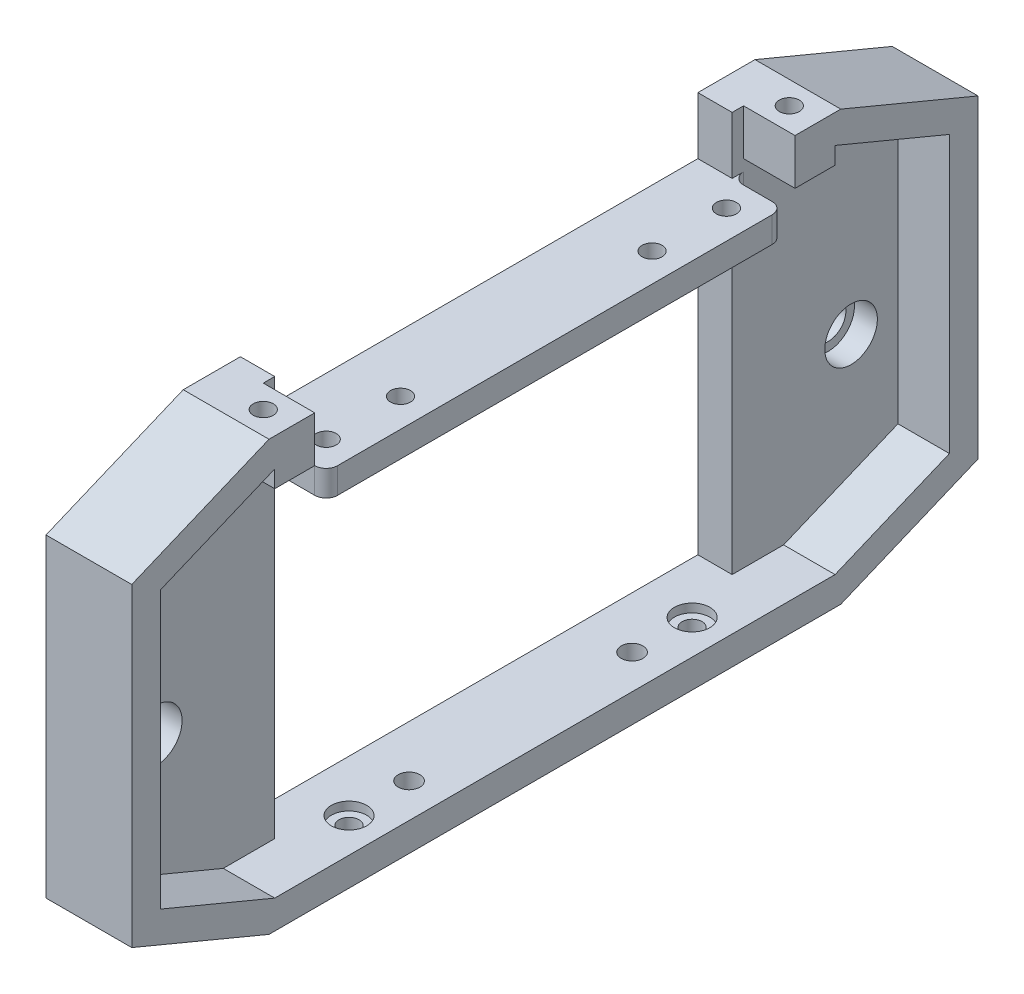
from build123d import *

# Parameters (mm, degrees)
SKETCH13_R              = 4.6
SKETCH13_W              = 80
SKETCH13_H              = 55
BOSS_EXTRUDE4_DEPTH     = 15
CUT_EXTRUDE1_DEPTH      = 9
CUT_EXTRUDE2_DEPTH      = 146.691454794
CUT_EXTRUDE2_DEPTH_BACK = 6
SKETCH16_R              = 1.75
FILLET1_R               = 2
SKETCH17_R              = 1.75
CUT_EXTRUDE3_DEPTH      = 10
SKETCH18_R              = 1.75
SKETCH18_R_2            = 1.9
CUT_EXTRUDE4_DEPTH      = 10
SKETCH21_R              = 4.6
SKETCH21_R_2            = 3.1
BOSS_EXTRUDE7_DEPTH     = 2
SKETCH22_R              = 3.1
CUT_EXTRUDE5_DEPTH      = 1.5
SKETCH23_W              = 9
SKETCH23_H              = 7
SKETCH23_R              = 1.75
BOSS_EXTRUDE8_DEPTH     = 3


with BuildPart() as part:
    # Sketch13 → Boss-Extrude4 (new body)
    with BuildSketch(Plane(origin=(0, 0, 0), x_dir=(0, 0, -1), z_dir=(1, 0, 0))):
        Polygon((0, 0), (-24, 10), (-24, 65), (0, 75), (10, 75), (10, 65), (90, 65), (90, 75), (100, 75), (124, 65), (124, 10), (100, 0), align=None)
        with Locations((-10.8, 31)):
            Circle(SKETCH13_R, mode=Mode.SUBTRACT)
        with Locations((110.8, 31)):
            Circle(SKETCH13_R, mode=Mode.SUBTRACT)
        with Locations((50, 32.5)):
            Rectangle(SKETCH13_W, SKETCH13_H, mode=Mode.SUBTRACT)
    extrude(amount=BOSS_EXTRUDE4_DEPTH)

    # Sketch14 → Cut-Extrude1 (cut)
    with BuildSketch(Plane(origin=(15, 0, 0), x_dir=(0, 0, -1), z_dir=(1, 0, 0))):
        Polygon((10, 70.5), (10, 60.5), (90, 60.5), (90, 70.5), (90, 75), (92, 75), (92, 70), (99, 70), (119, 61.666666667), (119, 13.333333333), (99, 5), (1, 5), (-19, 13.333333333), (-19, 61.666666667), (1, 70), (8, 70), (8, 75), (10, 75), align=None)
    extrude(amount=-CUT_EXTRUDE1_DEPTH, mode=Mode.SUBTRACT)

    # Sketch16 → Cut-Extrude2 (cut, two sides: drawn at the far end of the back side and taken through both)
    with BuildSketch(Plane(origin=(0, 75, 0), x_dir=(1, 0, 0), z_dir=(0, 1, 0)).offset(-CUT_EXTRUDE2_DEPTH_BACK)):
        with Locations(Location((10, 4, 0), (0, 0, 90))):
            Circle(SKETCH16_R)
        with Locations(Location((10, 96, 0), (0, 0, 90))):
            Circle(SKETCH16_R)
    extrude(amount=CUT_EXTRUDE2_DEPTH + CUT_EXTRUDE2_DEPTH_BACK, mode=Mode.SUBTRACT)

    # Fillet1
    fillet1_edges = [part.edges().sort_by_distance(p)[0] for p in [
        (6, 62.75, -90),
        (6, 62.75, -10),
        (15, 62.75, -90),
        (15, 62.75, -10),
    ]]
    fillet(fillet1_edges, radius=FILLET1_R)

    # Sketch17 → Cut-Extrude3 (cut)
    with BuildSketch(Plane(origin=(0, 65, 0), x_dir=(1, 0, 0), z_dir=(0, 1, 0))):
        with Locations(Location((10, 15, 0), (0, 0, 270))):
            Circle(SKETCH17_R)
        with Locations(Location((10, 85, 0), (0, 0, 270))):
            Circle(SKETCH17_R)
        with Locations(Location((10, 72, 0), (0, 0, 270))):
            Circle(SKETCH17_R)
        with Locations(Location((10, 28, 0), (0, 0, 270))):
            Circle(SKETCH17_R)
    extrude(amount=-CUT_EXTRUDE3_DEPTH, mode=Mode.SUBTRACT)

    # Sketch18 → Cut-Extrude4 (cut)
    with BuildSketch(Plane.XZ):
        with Locations(Location((9, -20, 0), (0, 0, 270))):
            Circle(SKETCH18_R)
        with Locations(Location((9, -80, 0), (0, 0, 270))):
            Circle(SKETCH18_R)
        with Locations(Location((9, -30.5, 0), (0, 0, 270))):
            Circle(SKETCH18_R_2)
        with Locations(Location((9, -69.5, 0), (0, 0, 270))):
            Circle(SKETCH18_R_2)
    extrude(amount=-CUT_EXTRUDE4_DEPTH, mode=Mode.SUBTRACT)

    # Sketch21 → Boss-Extrude7 (add)
    # profile 1 of 2: a face of its own
    with BuildSketch(Plane.ZY):
        with Locations((-110.8, 31)):
            Circle(SKETCH21_R)
        with Locations((-110.8, 31)):
            Circle(SKETCH21_R_2, mode=Mode.SUBTRACT)
    # profile 2 of 2: a face of its own
    with BuildSketch(Plane.ZY):
        with Locations((10.8, 31)):
            Circle(SKETCH21_R)
        with Locations((10.8, 31)):
            Circle(SKETCH21_R_2, mode=Mode.SUBTRACT)
    extrude(amount=-BOSS_EXTRUDE7_DEPTH)

    # Sketch22 → Cut-Extrude5 (cut)
    with BuildSketch(Plane(origin=(0, 5, 0), x_dir=(1, 0, 0), z_dir=(0, 1, 0))):
        with Locations(Location((9, 20, 0), (0, 0, 270))):
            Circle(SKETCH22_R)
        with Locations(Location((9, 80, 0), (0, 0, 270))):
            Circle(SKETCH22_R)
    extrude(amount=-CUT_EXTRUDE5_DEPTH, mode=Mode.SUBTRACT)

    # Sketch23 → Boss-Extrude8 (add)
    # profile 1 of 2: a face of its own
    with BuildSketch(Plane.XZ.offset(-70)):
        with Locations((10.5, -95.5)):
            Rectangle(SKETCH23_W, SKETCH23_H)
        with Locations(Location((10, -96, 0), (0, 0, 270))):
            Circle(SKETCH23_R, mode=Mode.SUBTRACT)
    # profile 2 of 2: a face of its own
    with BuildSketch(Plane.XZ.offset(-70)):
        with Locations((10.5, -4.5)):
            Rectangle(SKETCH23_W, SKETCH23_H)
        with Locations(Location((10, -4, 0), (0, 0, 270))):
            Circle(SKETCH23_R, mode=Mode.SUBTRACT)
    extrude(amount=BOSS_EXTRUDE8_DEPTH)


solid = part.part
